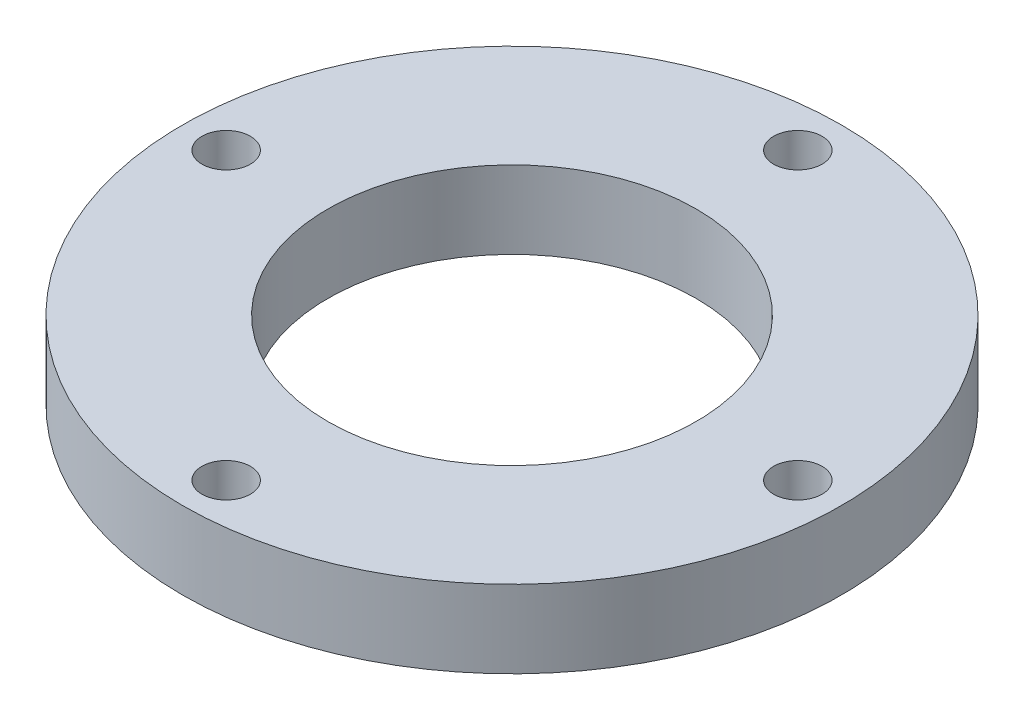
from build123d import *

# Parameters (mm, degrees)
SKETCH_1_R          = 34
SKETCH_1_R_2        = 19
EXTRUDE_1_DEPTH     = 8
SKETCH_2_R          = 2.5
CUT_EXTRUDE_1_DEPTH = 49.744230428


with BuildPart() as part:
    # Эскиз1 → Вытянуть1 (new body)
    with BuildSketch(Plane(origin=(0, 0, 0), x_dir=(1, 0, 0), z_dir=(0, 1, 0))):
        with Locations(Location((0, 0, 0), (0, 0, 270))):
            Circle(SKETCH_1_R)
        with Locations(Location((0, 0, 0), (0, 0, 270))):
            Circle(SKETCH_1_R_2, mode=Mode.SUBTRACT)
    extrude(amount=EXTRUDE_1_DEPTH)

    # Эскиз2 → Вырез-Вытянуть1 (cut, through all)
    with BuildSketch(Plane(origin=(0, 8, 0), x_dir=(1, 0, 0), z_dir=(0, 1, 0))):
        with Locations(Location((0, 29.48960133, 0), (0, 0, 270))):
            Circle(SKETCH_2_R)
        with Locations(Location((29.48960133, 0, 0), (0, 0, 270))):
            Circle(SKETCH_2_R)
        with Locations(Location((0, -29.48960133, 0), (0, 0, 270))):
            Circle(SKETCH_2_R)
        with Locations(Location((-29.48960133, 0, 0), (0, 0, 270))):
            Circle(SKETCH_2_R)
    extrude(amount=-CUT_EXTRUDE_1_DEPTH, mode=Mode.SUBTRACT)


solid = part.part
